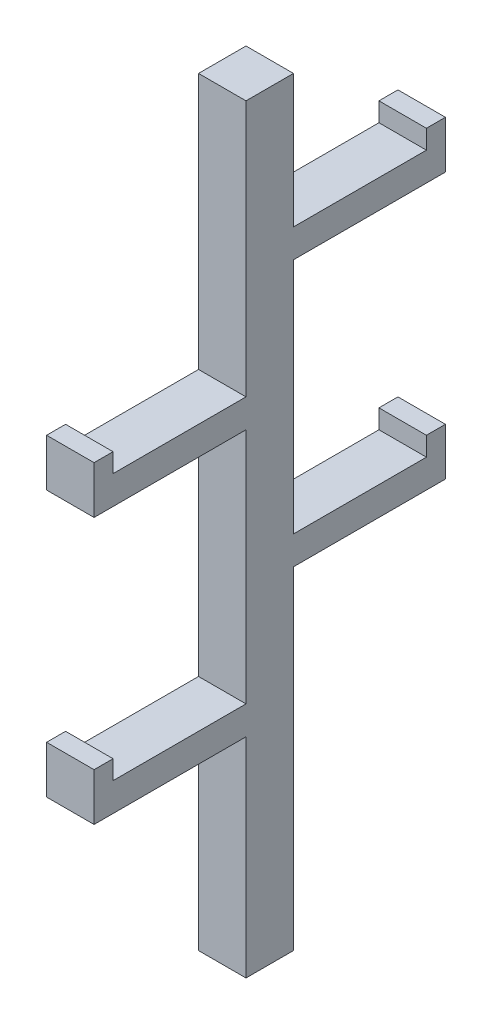
from build123d import *

# Parameters (mm, degrees)
SKETCH1_W           = 6.35
SKETCH1_H           = 6.35
BOSS_EXTRUDE1_DEPTH = 101.6
SKETCH4_W           = 6.35
SKETCH4_H           = 3.81
BOSS_EXTRUDE2_DEPTH = 20.32
SKETCH5_W           = 6.35
SKETCH5_H           = 2.54
BOSS_EXTRUDE3_DEPTH = 2.54
SKETCH6_W           = 6.35
SKETCH6_H           = 3.81
BOSS_EXTRUDE4_DEPTH = 20.32
SKETCH7_W           = 6.35
SKETCH7_H           = 2.54
BOSS_EXTRUDE5_DEPTH = 2.54
SKETCH9_W           = 6.35
SKETCH9_H           = 2.54
BOSS_EXTRUDE6_DEPTH = 2.54
SKETCH8_W           = 6.35
SKETCH8_H           = 2.54
BOSS_EXTRUDE7_DEPTH = 2.54


with BuildPart() as part:
    # Sketch1 → Boss-Extrude1 (new body)
    with BuildSketch(Plane(origin=(0, 0, 0), x_dir=(1, 0, 0), z_dir=(0, 1, 0))):
        Rectangle(SKETCH1_W, SKETCH1_H)
    extrude(amount=BOSS_EXTRUDE1_DEPTH)

    # Sketch4 → Boss-Extrude2 (add)
    with BuildSketch(Plane.XY.offset(3.175)):
        with Locations((0, 29.845)):
            Rectangle(SKETCH4_W, SKETCH4_H)
        with Locations((0, 65.405)):
            Rectangle(SKETCH4_W, SKETCH4_H)
    extrude(amount=BOSS_EXTRUDE2_DEPTH)

    # Sketch5 → Boss-Extrude3 (add)
    with BuildSketch(Plane(origin=(0, 31.75, 0), x_dir=(1, 0, 0), z_dir=(0, 1, 0))):
        with Locations((0, -22.225)):
            Rectangle(SKETCH5_W, SKETCH5_H)
    extrude(amount=BOSS_EXTRUDE3_DEPTH)

    # Sketch6 → Boss-Extrude4 (add)
    with BuildSketch(Plane(origin=(0, 0, -3.175), x_dir=(-1, 0, 0), z_dir=(0, 0, -1))):
        with Locations((0, 81.915)):
            Rectangle(SKETCH6_W, SKETCH6_H)
        with Locations((0, 46.355)):
            Rectangle(SKETCH6_W, SKETCH6_H)
    extrude(amount=BOSS_EXTRUDE4_DEPTH)

    # Sketch7 → Boss-Extrude5 (add)
    with BuildSketch(Plane(origin=(0, 48.26, 0), x_dir=(1, 0, 0), z_dir=(0, 1, 0))):
        with Locations((0, 22.225)):
            Rectangle(SKETCH7_W, SKETCH7_H)
    extrude(amount=BOSS_EXTRUDE5_DEPTH)

    # Sketch9 → Boss-Extrude6 (add)
    with BuildSketch(Plane(origin=(0, 83.82, 0), x_dir=(1, 0, 0), z_dir=(0, 1, 0))):
        with Locations((0, 22.225)):
            Rectangle(SKETCH9_W, SKETCH9_H)
    extrude(amount=BOSS_EXTRUDE6_DEPTH)

    # Sketch8 → Boss-Extrude7 (add)
    with BuildSketch(Plane(origin=(0, 67.31, 0), x_dir=(1, 0, 0), z_dir=(0, 1, 0))):
        with Locations((0, -22.225)):
            Rectangle(SKETCH8_W, SKETCH8_H)
    extrude(amount=BOSS_EXTRUDE7_DEPTH)


solid = part.part
